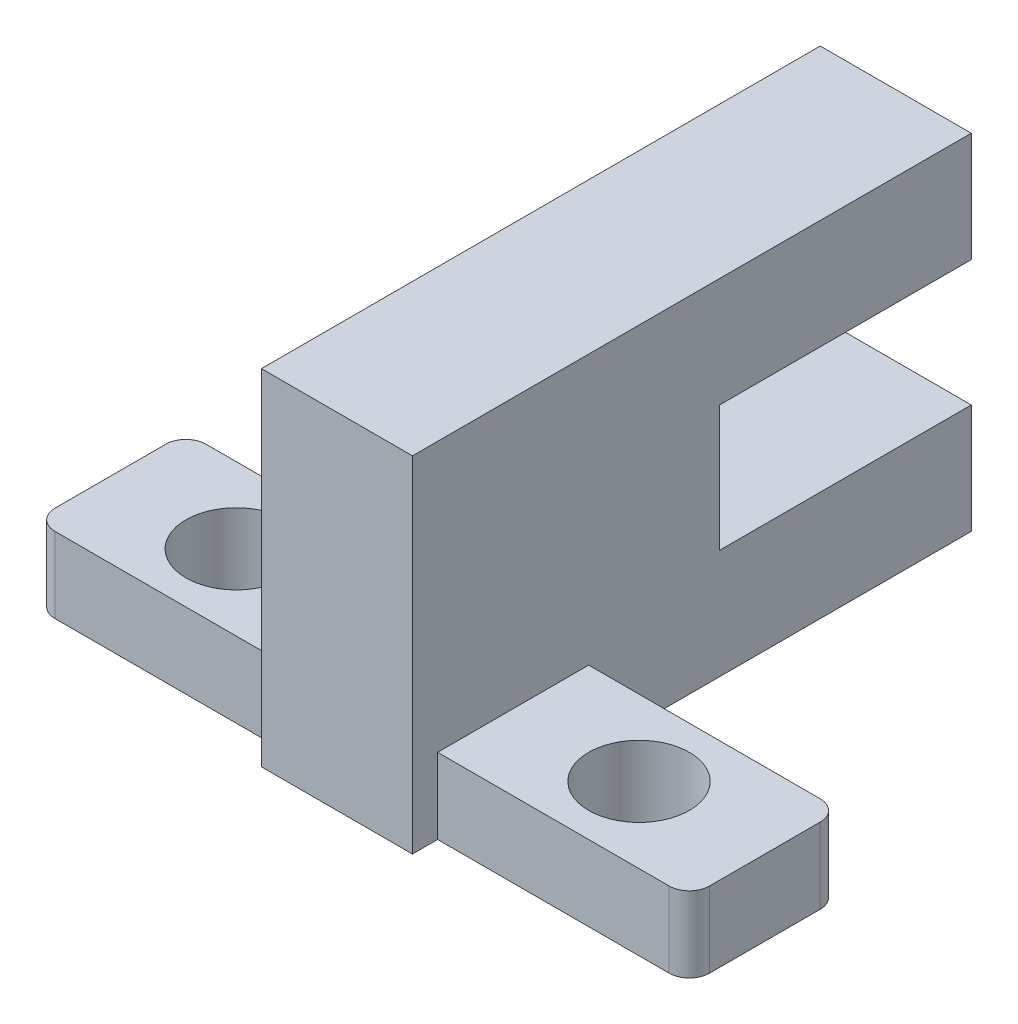
from build123d import *

# Parameters (mm, degrees)
BOSS_EXTRUDE1_DEPTH      = 6
BOSS_EXTRUDE2_DEPTH      = 10
BOSS_EXTRUDE2_DEPTH_BACK = 16
SKETCH2_W                = 6
SKETCH2_H                = 3
SKETCH3_R                = 2
CUT_EXTRUDE1_DEPTH       = 10
FILLET1_R                = 0.8


with BuildPart() as part:
    # Sketch1 → Boss-Extrude1 (new body)
    with BuildSketch(Plane(origin=(0, 0, 0), x_dir=(0, 0, -1), z_dir=(1, 0, 0))):
        Polygon((11.1, 6.85), (-11.1, 6.85), (-11.1, -6.85), (11.1, -6.85), (11.1, -2.5), (1.1, -2.5), (1.1, 2.5), (11.1, 2.5), align=None)
    extrude(amount=BOSS_EXTRUDE1_DEPTH)

    # Sketch2 → Boss-Extrude2 (add, two sides: drawn at the far end of the back side and taken through both)
    with BuildSketch(Plane(origin=(6, 0, 0), x_dir=(0, 0, -1), z_dir=(1, 0, 0)).offset(-BOSS_EXTRUDE2_DEPTH_BACK)):
        with Locations((-7.1, -5.35)):
            Rectangle(SKETCH2_W, SKETCH2_H)
    extrude(amount=BOSS_EXTRUDE2_DEPTH + BOSS_EXTRUDE2_DEPTH_BACK)

    # Sketch3 → Cut-Extrude1 (cut)
    with BuildSketch(Plane(origin=(0, -3.85, 0), x_dir=(1, 0, 0), z_dir=(0, 1, 0))):
        with Locations((11, -7.1)):
            Circle(SKETCH3_R)
        with Locations((-5, -7.1)):
            Circle(SKETCH3_R)
    extrude(amount=-CUT_EXTRUDE1_DEPTH, mode=Mode.SUBTRACT)

    # Fillet1
    fillet1_edges = [part.edges().sort_by_distance(p)[0] for p in [
        (16, -5.35, 10.1),
        (16, -5.35, 4.1),
        (-10, -5.35, 10.1),
        (-10, -5.35, 4.1),
    ]]
    fillet(fillet1_edges, radius=FILLET1_R)


solid = part.part
